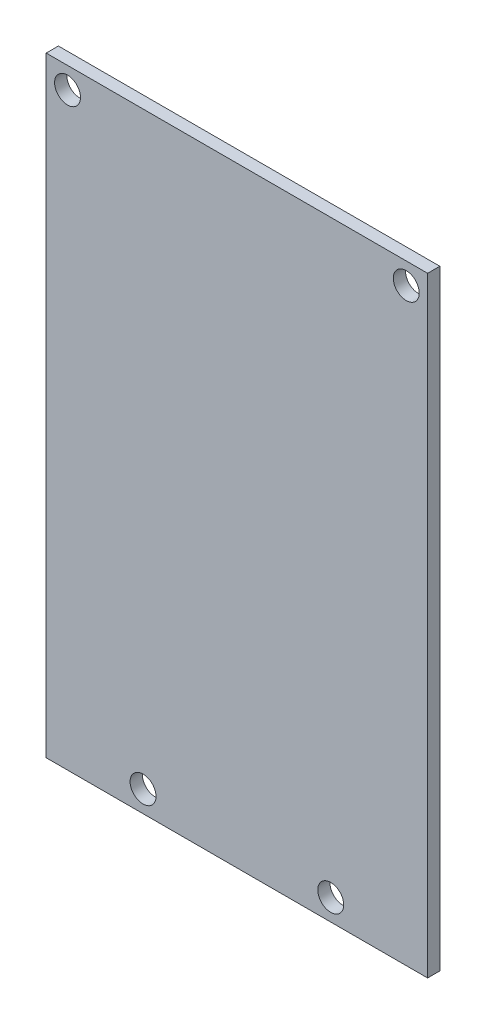
from build123d import *

# Parameters (mm, degrees)
ESQUISSE1_W        = 50
ESQUISSE1_H        = 80
BOSS_EXTRU_1_DEPTH = 1.6
D_GAGEMENT_M31_D   = 3.4


with BuildPart() as part:
    # Esquisse1 → Boss.-Extru.1 (new body)
    with BuildSketch(Plane.XY):
        Rectangle(ESQUISSE1_W, ESQUISSE1_H)
    extrude(amount=BOSS_EXTRU_1_DEPTH)

    # Dégagement M31 (through all)
    with Locations(Plane.XY.offset(1.6)):
        with Locations((-22.2, 37.2), (22.2, 37.2), (12.3, -37.2), (-12.3, -37.2)):
            Hole(D_GAGEMENT_M31_D / 2)


solid = part.part
